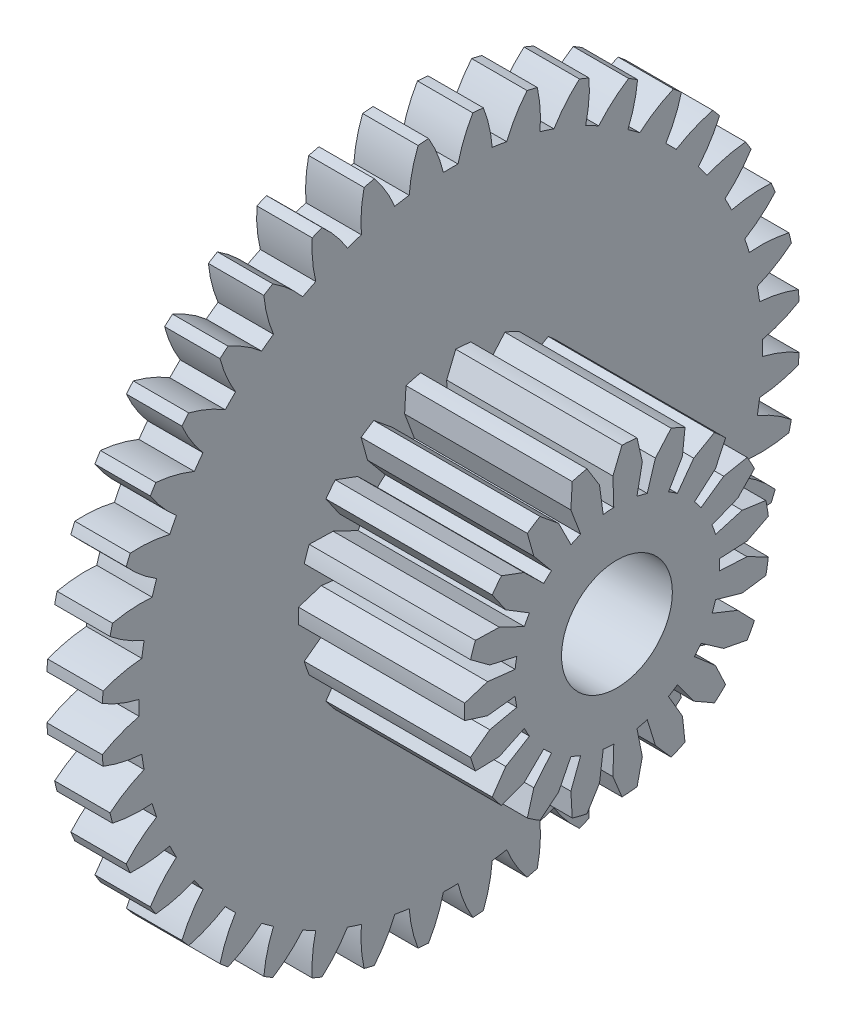
from build123d import *

# Parameters (mm, degrees)
BASPROSKE_W                  = 1
BASPROSKE_H                  = 6.3
TOOTHCUT_DEPTH               = 9.96548939
TEETHCUTS_COUNT              = 40
TEETHCUTS_ANGLE              = 351
BORSKE_R                     = 1
BORE_DEPTH                   = 50.0000508
ESTRUSIONE_ESTRUSIONE1_START = 3
SCHIZZO2_R                   = 2.75
SCHIZZO2_R_2                 = 1
ESTRUSIONE_ESTRUSIONE1_DEPTH = 3
TAGLIO_ESTRUSIONE2_DEPTH     = 3
RIPETIZIONECIRCOLARE1_COUNT  = 19


with BuildPart() as part:
    # BasProSke → Base-Revolve (revolve)
    with BuildSketch(Plane(origin=(0, 0, 0), x_dir=(1, 0, 0), z_dir=(0, 1, 0)), mode=Mode.PRIVATE) as base_revolve_sk:
        with Locations((0.5, 3.15)):
            Rectangle(BASPROSKE_W, BASPROSKE_H)
    revolve(base_revolve_sk.sketch.rotate(Axis((-10, 0, 0), (1, 0, 0)), 180), axis=Axis((-10, 0, 0), (1, 0, 0)))

    # TooCutSke → ToothCut (cut, through all)
    with BuildSketch(Plane(origin=(0, 0, 0), x_dir=(0, 0, -1), z_dir=(1, 0, 0))):
        with BuildLine():
            ThreePointArc((0.132139403, 5.622447437), (0, 5.624), (-0.132139403, 5.622447437))
            ThreePointArc((-0.132139403, 5.622447437), (-0.246228658, 5.978143985), (-0.414130153, 6.311828687))
            ThreePointArc((-0.414130153, 6.311828687), (0, 6.3254), (0.414130153, 6.311828687))
            ThreePointArc((0.414130153, 6.311828687), (0.246228658, 5.978143985), (0.132139403, 5.622447437))
        make_face()
    toothcut = extrude(amount=TOOTHCUT_DEPTH, mode=Mode.SUBTRACT)

    # TeethCuts: ToothCut ×40 about axis
    teethcuts_axis = Axis((-10, 0, 0), (1, 0, 0))
    for i in range(1, TEETHCUTS_COUNT):
        add(toothcut.rotate(teethcuts_axis, i * TEETHCUTS_ANGLE / (TEETHCUTS_COUNT - 1)), mode=Mode.SUBTRACT)

    # BorSke → Bore (cut, symmetric)
    with BuildSketch(Plane(origin=(0, 0, 0), x_dir=(0, 0, -1), z_dir=(1, 0, 0))):
        with Locations(Location((0, 0, 0), (0, 0, 180))):
            Circle(BORSKE_R)
    extrude(amount=BORE_DEPTH, both=True, mode=Mode.SUBTRACT)

    # Schizzo2 → Estrusione-Estrusione1 (add)
    with BuildSketch(Plane(origin=(1, 0, 0), x_dir=(0, 0, -1), z_dir=(1, 0, 0)).offset(ESTRUSIONE_ESTRUSIONE1_START)):
        with Locations(Location((0, 0, 0), (0, 0, 180))):
            Circle(SCHIZZO2_R)
        Circle(SCHIZZO2_R_2, mode=Mode.SUBTRACT)
    extrude(amount=-ESTRUSIONE_ESTRUSIONE1_DEPTH)

    # Schizzo1 → Taglio-Estrusione2 (cut)
    with BuildSketch(Plane(origin=(4, 0, 0), x_dir=(0, 0, -1), z_dir=(1, 0, 0))):
        with BuildLine():
            Line((2.34685834, 0.121473988), (1.847526779, 0.095628458))
            ThreePointArc((1.847526779, 0.095628458), (1.85, 0), (1.847526779, -0.095628458))
            Line((1.847526779, -0.095628458), (2.34685834, -0.121473988))
            Line((2.34685834, -0.121473988), (2.73164199, -0.317225533))
            ThreePointArc((2.73164199, -0.317225533), (2.75, 0), (2.73164199, 0.317225533))
            Line((2.73164199, 0.317225533), (2.34685834, 0.121473988))
        make_face()
    taglio_estrusione2 = extrude(amount=-TAGLIO_ESTRUSIONE2_DEPTH, mode=Mode.SUBTRACT)

    # RipetizioneCircolare1: Taglio-Estrusione2 ×19 about axis
    ripetizionecircolare1_axis = Axis((0, 0, 0), (1, 0, 0))
    for i in range(1, RIPETIZIONECIRCOLARE1_COUNT):
        add(taglio_estrusione2.rotate(ripetizionecircolare1_axis, i * 360 / RIPETIZIONECIRCOLARE1_COUNT), mode=Mode.SUBTRACT)


solid = part.part
